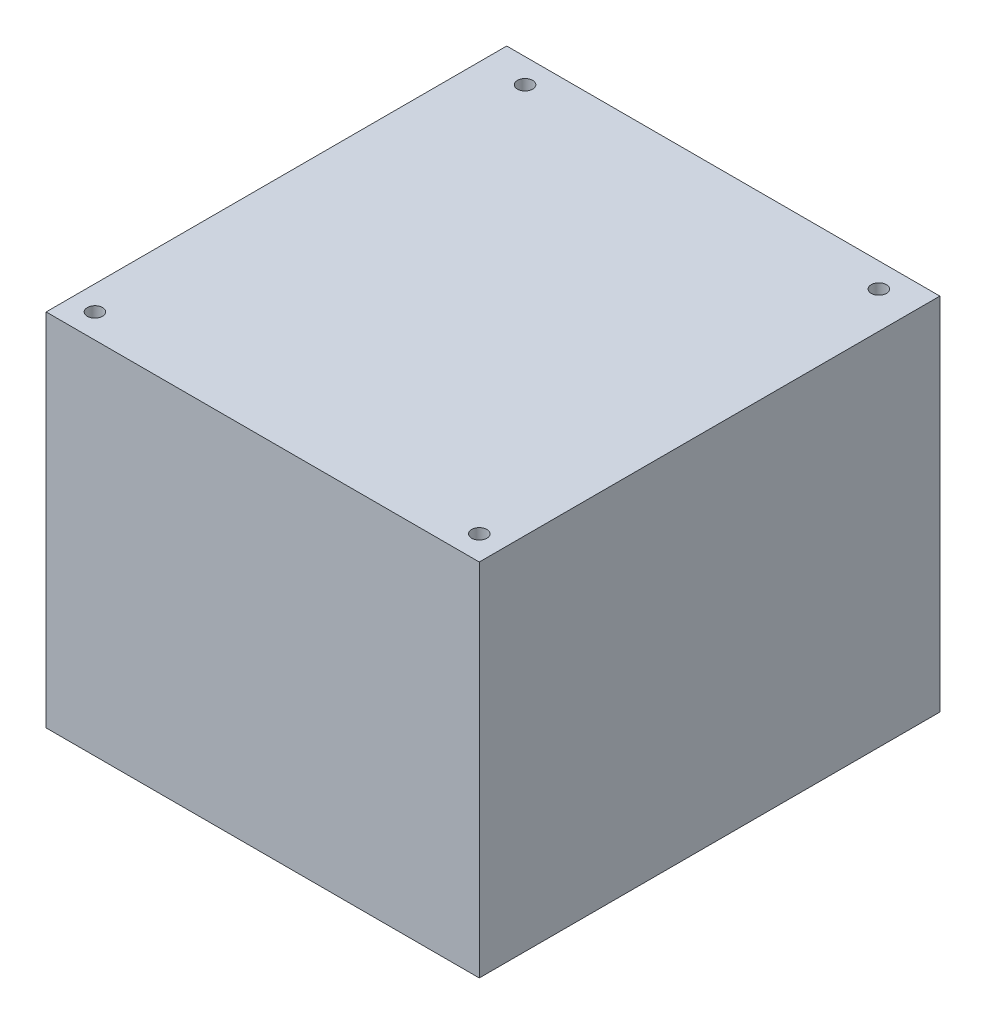
from build123d import *

# Parameters (mm, degrees)
SKETCH1_W           = 90.17
SKETCH1_H           = 95.885
BOSS_EXTRUDE1_DEPTH = 75
SKETCH2_R           = 1.5875
CUT_EXTRUDE1_DEPTH  = 100.780461671


with BuildPart() as part:
    # Sketch1 → Boss-Extrude1 (new body)
    with BuildSketch(Plane(origin=(0, 0, 0), x_dir=(1, 0, 0), z_dir=(0, 1, 0))):
        Rectangle(SKETCH1_W, SKETCH1_H)
    extrude(amount=BOSS_EXTRUDE1_DEPTH)

    # Sketch2 → Cut-Extrude1 (cut, through all)
    with BuildSketch(Plane(origin=(0, 75, 0), x_dir=(1, 0, 0), z_dir=(0, 1, 0))):
        with Locations(Location((-40.005, -42.8625, 0), (0, 0, 270))):
            Circle(SKETCH2_R)
        with Locations(Location((40.005, -42.8625, 0), (0, 0, 270))):
            Circle(SKETCH2_R)
        with Locations(Location((-36.195, 42.8625, 0), (0, 0, 270))):
            Circle(SKETCH2_R)
        with Locations(Location((37.465, 42.8625, 0), (0, 0, 270))):
            Circle(SKETCH2_R)
    extrude(amount=-CUT_EXTRUDE1_DEPTH, mode=Mode.SUBTRACT)


solid = part.part
